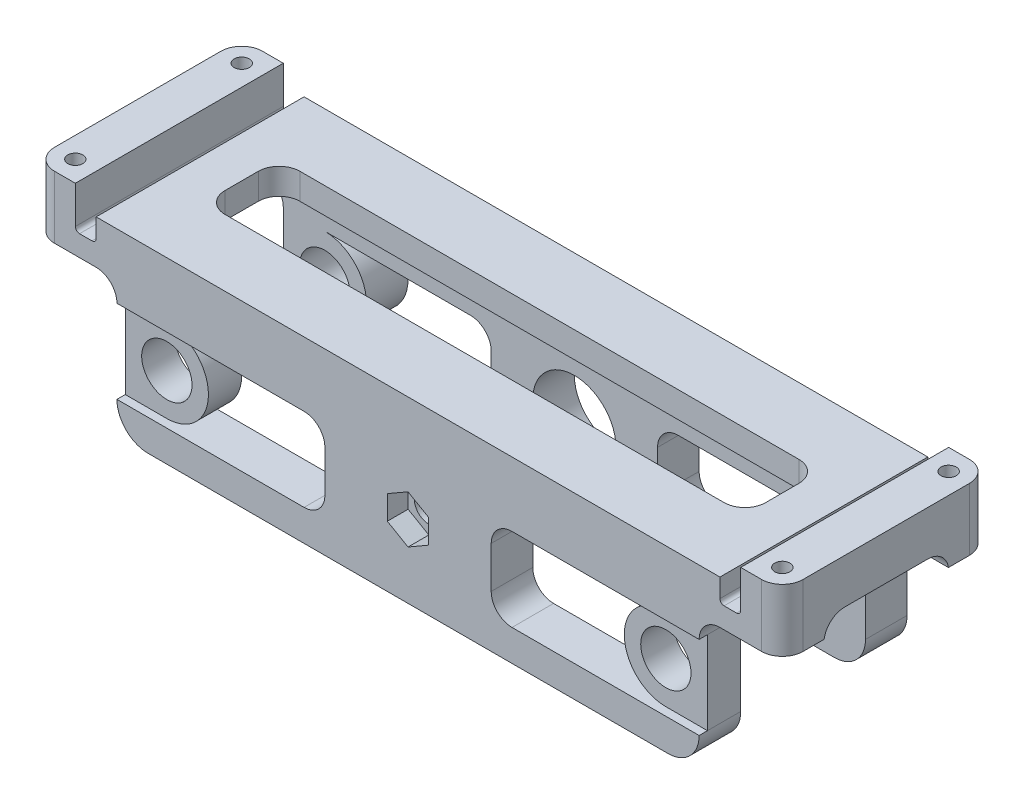
from build123d import *

# Parameters (mm, degrees)
SKETCH_1_W                 = 150
SKETCH_1_H                 = 50
EXTRUDE_1_DEPTH            = 10
CUT_EXTRUDE_5_DEPTH        = 5
SKETCH_6_R                 = 6.05
CUT_EXTRUDE_6_DEPTH        = 80.686887253
CUT_EXTRUDE_7_DEPTH        = 80.686887253
CUT_EXTRUDE_8_DEPTH        = 80.686887253
SKETCH_9_R                 = 3.5
CUT_EXTRUDE_9_DEPTH        = 80.214897721
SKETCH_10_W                = 150
SKETCH_10_H                = 1.5
CUT_EXTRUDE_10_DEPTH       = 80.686887391
SKETCH_11_W                = 150
SKETCH_11_H                = 4.25
EXTRUDE_3_DEPTH            = 15
CUT_EXTRUDE_12_REACH       = 95.152
SKETCH_14_R                = 10
SKETCH_15_W                = 130
SKETCH_15_H                = 18
CUT_EXTRUDE_13_DEPTH       = 93.604333216
FILLET_1_R                 = 5
EXTRUDE_4_DEPTH            = 15
EXTRUDE_5_DEPTH            = 15
FILLET_2_R                 = 5
HOLE_WIZARD_M31_AT_2_COUNT = 2
HOLE_WIZARD_M31_AT_2_PITCH = 40
HOLE_WIZARD_M31_AT_3_COUNT = 2
HOLE_WIZARD_M31_AT_3_PITCH = 170
HOLE_WIZARD_M31_AT_4_COUNT = 2
HOLE_WIZARD_M31_AT_4_PITCH = 174.642491966
CUT_EXTRUDE_20_DEPTH       = 2
SKETCH_22_W                = 5
SKETCH_22_H                = 50
CUT_EXTRUDE_21_DEPTH       = 5
FILLET_3_R                 = 1
FILLET_4_R                 = 5
EXTRUDE_START              = 5
SKETCH_23_R                = 1.825
EXTRUDE_7_DEPTH            = 5
EXTRUDE_START_2            = 2
SKETCH_24_W                = 150
SKETCH_24_H                = 50
EXTRUDE_8_DEPTH            = 2


with BuildPart() as part:
    # Эскиз1 → Бобышка-Вытянуть1 (new body)
    with BuildSketch(Plane.XY):
        Rectangle(SKETCH_1_W, SKETCH_1_H)
    extrude(amount=EXTRUDE_1_DEPTH)

    # Эскиз5 → Вырез-Вытянуть5 (cut)
    with BuildSketch(Plane.XY.offset(10)):
        Polygon((0, 5.75), (-4.979646072, 2.875), (-4.979646072, -2.875), (0, -5.75), (4.979646072, -2.875), (4.979646072, 2.875), align=None)
    extrude(amount=-CUT_EXTRUDE_5_DEPTH, mode=Mode.SUBTRACT)

    # Эскиз6 → Вырез-Вытянуть6 (cut, through all)
    with BuildSketch(Plane.XY.offset(10)):
        with Locations((-60, 0)):
            Circle(SKETCH_6_R)
        with Locations(Location((60, 0, 0), (0, 0, 180))):
            Circle(SKETCH_6_R)
    extrude(amount=-CUT_EXTRUDE_6_DEPTH, mode=Mode.SUBTRACT)

    # Эскиз7 → Вырез-Вытянуть7 (cut, through all)
    with BuildSketch(Plane.XY.offset(10)):
        with BuildLine():
            Line((65, -25), (75, -25))
            Line((75, -25), (75, -15))
            Line((75, -15), (75, 15))
            ThreePointArc((75, 15), (71.464466094, 13.535533906), (70, 10))
            Line((70, 10), (70, -10))
            ThreePointArc((70, -10), (67.803300859, -15.303300859), (62.5, -17.5))
            Line((62.5, -17.5), (27.5, -17.5))
            Line((27.5, -17.5), (-2.5, -17.5))
            Line((-2.5, -17.5), (-32.5, -17.5))
            Line((-32.5, -17.5), (-62.5, -17.5))
            ThreePointArc((-62.5, -17.5), (-67.803300859, -15.303300859), (-70, -10))
            Line((-70, -10), (-70, 10))
            ThreePointArc((-70, 10), (-71.464466094, 13.535533906), (-75, 15))
            Line((-75, 15), (-75, -15))
            Line((-75, -15), (-75, -25))
            Line((-75, -25), (-65, -25))
            Line((-65, -25), (-25, -25))
            Line((-25, -25), (25, -25))
            Line((25, -25), (65, -25))
        make_face()
    extrude(amount=-CUT_EXTRUDE_7_DEPTH, mode=Mode.SUBTRACT)

    # Эскиз8 → Вырез-Вытянуть8 (cut, through all)
    with BuildSketch(Plane(origin=(0, 0, 0), x_dir=(-1, 0, 0), z_dir=(0, 0, -1))):
        with BuildLine():
            Line((20, -5), (20, 5))
            ThreePointArc((20, 5), (21.464466094, 8.535533906), (25, 10))
            Line((25, 10), (45, 10))
            add(Edge.make_bspline(
                [(60, 10), (59.955521003, 10), (54.127943117, 10), (45, 10)],
                knots=[0, 0, 0, 0, 1, 1, 1, 1], degree=3))
            ThreePointArc((60, 10), (50, 0), (60, -10))
            add(Edge.make_bspline(
                [(60, -10), (59.955521003, -10), (54.127943117, -10), (45, -10)],
                knots=[0, 0, 0, 0, 1, 1, 1, 1], degree=3))
            Line((45, -10), (25, -10))
            ThreePointArc((25, -10), (21.464466094, -8.535533906), (20, -5))
        make_face()
        with BuildLine():
            Line((-45, -10), (-25, -10))
            ThreePointArc((-25, -10), (-21.464466094, -8.535533906), (-20, -5))
            Line((-20, -5), (-20, 5))
            ThreePointArc((-20, 5), (-21.464466094, 8.535533906), (-25, 10))
            Line((-25, 10), (-45, 10))
            add(Edge.make_bspline(
                [(-60, 10), (-59.955521003, 10), (-54.127943117, 10), (-45, 10)],
                knots=[0, 0, 0, 0, 1, 1, 1, 1], degree=3))
            ThreePointArc((-60, 10), (-50, 0), (-60, -10))
            add(Edge.make_bspline(
                [(-60, -10), (-59.955521003, -10), (-54.127943117, -10), (-45, -10)],
                knots=[0, 0, 0, 0, 1, 1, 1, 1], degree=3))
        make_face()
    extrude(amount=-CUT_EXTRUDE_8_DEPTH, mode=Mode.SUBTRACT)

    # Эскиз9 → Вырез-Вытянуть9 (cut, through all)
    with BuildSketch(Plane.XY.offset(5)):
        Circle(SKETCH_9_R)
    extrude(amount=-CUT_EXTRUDE_9_DEPTH, mode=Mode.SUBTRACT)

    # Эскиз10 → Вырез-Вытянуть10 (cut, through all)
    with BuildSketch(Plane.XY.offset(10)):
        with Locations((0, 24.25)):
            Rectangle(SKETCH_10_W, SKETCH_10_H)
    extrude(amount=-CUT_EXTRUDE_10_DEPTH, mode=Mode.SUBTRACT)

    # Эскиз11 → Бобышка-Вытянуть3 (add)
    with BuildSketch(Plane(origin=(0, 0, 0), x_dir=(-1, 0, 0), z_dir=(0, 0, -1))):
        with Locations((0, 21.375)):
            Rectangle(SKETCH_11_W, SKETCH_11_H)
    extrude(amount=EXTRUDE_3_DEPTH)

    # Зеркальное отражение9: part across plane


with BuildPart() as part_1:
    add(part.part)
    add(part.part.mirror(Plane(origin=(0, 0, -15), x_dir=(1, 0, 0), z_dir=(0, 0, -1))))

    # Эскиз14 → Вырез-Вытянуть12 (cut, up to next)
    with BuildSketch(Plane(origin=(0, 0, -40), x_dir=(-1, 0, 0), z_dir=(0, 0, -1)), mode=Mode.PRIVATE) as cut_extrude_12_sk1:
        Circle(SKETCH_14_R)
    cut_extrude_12_tool1 = extrude(cut_extrude_12_sk1.sketch, amount=-CUT_EXTRUDE_12_REACH, mode=Mode.PRIVATE) & part_1.part
    add(cut_extrude_12_tool1.solids().sort_by_distance((0, 0, -40))[0], mode=Mode.SUBTRACT)

    # Эскиз15 → Вырез-Вытянуть13 (cut, through all)
    with BuildSketch(Plane.XZ.offset(-19.25)):
        with Locations((0, -15)):
            Rectangle(SKETCH_15_W, SKETCH_15_H)
    extrude(amount=-CUT_EXTRUDE_13_DEPTH, mode=Mode.SUBTRACT)

    # Скругление1
    fillet_1_edges = [part_1.edges().sort_by_distance(p)[0] for p in [
        (65, 21.375, -6),
        (65, 21.375, -24),
        (-65, 21.375, -24),
        (-65, 21.375, -6),
    ]]
    fillet(fillet_1_edges, radius=FILLET_1_R)

    # Эскиз18 → Бобышка-Вытянуть4 (add)
    with BuildSketch(Plane(origin=(75, 0, 0), x_dir=(0, 0, -1), z_dir=(1, 0, 0))):
        Polygon((-10, 23.5), (-10, 15), (0, 15), (0, 19.25), (30, 19.25), (30, 15), (40, 15), (40, 25), (-10, 25), align=None)
    extrude(amount=EXTRUDE_4_DEPTH)

    # Эскиз19 → Бобышка-Вытянуть5 (add)
    with BuildSketch(Plane.ZY.offset(75)):
        Polygon((-40, 15), (-30, 15), (-30, 19.25), (0, 19.25), (0, 15), (10, 15), (10, 25), (-40, 25), align=None)
    extrude(amount=EXTRUDE_5_DEPTH)

    # Скругление2
    fillet_2_edges = [part_1.edges().sort_by_distance(p)[0] for p in [
        (90, 20, 10),
        (90, 20, -40),
        (-90, 20, -40),
        (-90, 20, 10),
    ]]
    fillet(fillet_2_edges, radius=FILLET_2_R)

    # Эскиз20 → Цековка для винта с заклепочной головкой M31 (revolve, cut)
    with BuildSketch(Plane(origin=(-85, 15, -35), x_dir=(0, 0, -1), z_dir=(1, 0, 0))):
        Polygon((0, 0), (0, 10), (1.825, 10), (1.8, 9.975), (1.8, 2.425), (1.825, 2.4), (3.5, 2.4), (3.5, 0.025), (3.525, 0), align=None)
    hole_wizard_m31 = revolve(axis=Axis((-85, 8.65, -35), (0, 1, 0)), mode=Mode.SUBTRACT)

    # Цековка для винта с заклепочной головкой M31 at 2: Цековка для винта с заклепочной головкой M31 ×2
    with Locations(*[(0, 0, i * HOLE_WIZARD_M31_AT_2_PITCH) for i in range(1, HOLE_WIZARD_M31_AT_2_COUNT)]):
        add(hole_wizard_m31, mode=Mode.SUBTRACT)

    # Цековка для винта с заклепочной головкой M31 at 3: Цековка для винта с заклепочной головкой M31 ×2
    with Locations(*[(i * HOLE_WIZARD_M31_AT_3_PITCH, 0, 0) for i in range(1, HOLE_WIZARD_M31_AT_3_COUNT)]):
        add(hole_wizard_m31, mode=Mode.SUBTRACT)

    # Цековка для винта с заклепочной головкой M31 at 4: Цековка для винта с заклепочной головкой M31 ×2
    with Locations(*[Vector(0.9734171683335759, 0, 0.2290393337255473) * (i * HOLE_WIZARD_M31_AT_4_PITCH) for i in range(1, HOLE_WIZARD_M31_AT_4_COUNT)]):
        add(hole_wizard_m31, mode=Mode.SUBTRACT)

    # Эскиз21 → Вырез-Вытянуть20 (cut)
    with BuildSketch(Plane.XY.offset(10)):
        with BuildLine():
            Line((-60, 10), (-70, 10))
            Line((-70, 10), (-70, -10))
            Line((-70, -10), (-60, -10))
            ThreePointArc((-60, -10), (-50, 0), (-60, 10))
        make_face()
        with BuildLine():
            Line((60, 10), (70, 10))
            Line((70, 10), (70, -10))
            Line((70, -10), (60, -10))
            ThreePointArc((60, -10), (50, 0), (60, 10))
        make_face()
    extrude(amount=-CUT_EXTRUDE_20_DEPTH, mode=Mode.SUBTRACT)

    # Эскиз22 → Вырез-Вытянуть21 (cut)
    with BuildSketch(Plane(origin=(0, 25, 0), x_dir=(1, 0, 0), z_dir=(0, 1, 0))):
        with Locations((77.5, 15)):
            Rectangle(SKETCH_22_W, SKETCH_22_H)
        with Locations((-77.5, 15)):
            Rectangle(SKETCH_22_W, SKETCH_22_H)
    extrude(amount=-CUT_EXTRUDE_21_DEPTH, mode=Mode.SUBTRACT)

    # Скругление3
    fillet_3_edges = [part_1.edges().sort_by_distance(p)[0] for p in [
        (75, 20, -15),
        (80, 20, -15),
        (-75, 20, -15),
        (-80, 20, -15),
    ]]
    fillet(fillet_3_edges, radius=FILLET_3_R)

    # Скругление4
    fillet_4_edges = [part_1.edges().sort_by_distance(p)[0] for p in [
        (0, 19.25, 0),
        (0, 19.25, -30),
    ]]
    fillet(fillet_4_edges, radius=FILLET_4_R)

    # Эскиз23 → Бобышка-Вытянуть7 (add)
    # profile 1 of 2: a face of its own
    with BuildSketch(Plane(origin=(0, 25, 0), x_dir=(1, 0, 0), z_dir=(0, 1, 0)).offset(EXTRUDE_START)):
        with BuildLine():
            Line((-80, 40), (-80, -10))
            Line((-80, -10), (-85, -10))
            ThreePointArc((-85, -10), (-88.535533906, -8.535533906), (-90, -5))
            Line((-90, -5), (-90, 35))
            ThreePointArc((-90, 35), (-88.535533906, 38.535533906), (-85, 40))
            Line((-85, 40), (-80, 40))
        make_face()
        with Locations(Location((-85, 35, 0), (0, 0, 90))):
            Circle(SKETCH_23_R, mode=Mode.SUBTRACT)
        with Locations(Location((-85, -5, 0), (0, 0, 90))):
            Circle(SKETCH_23_R, mode=Mode.SUBTRACT)
    # profile 2 of 2: a face of its own
    with BuildSketch(Plane(origin=(0, 25, 0), x_dir=(1, 0, 0), z_dir=(0, 1, 0)).offset(EXTRUDE_START)):
        with BuildLine():
            Line((80, 40), (80, -10))
            Line((80, -10), (85, -10))
            ThreePointArc((85, -10), (88.535533906, -8.535533906), (90, -5))
            Line((90, -5), (90, 35))
            ThreePointArc((90, 35), (88.535533906, 38.535533906), (85, 40))
            Line((85, 40), (80, 40))
        make_face()
        with Locations(Location((85, 35, 0), (0, 0, 90))):
            Circle(SKETCH_23_R, mode=Mode.SUBTRACT)
        with Locations(Location((85, -5, 0), (0, 0, 90))):
            Circle(SKETCH_23_R, mode=Mode.SUBTRACT)
    extrude(amount=-EXTRUDE_7_DEPTH)

    # Эскиз24 → Бобышка-Вытянуть8 (add)
    with BuildSketch(Plane(origin=(0, 23.5, 0), x_dir=(1, 0, 0), z_dir=(0, 1, 0)).offset(EXTRUDE_START_2)):
        with Locations((0, 15)):
            Rectangle(SKETCH_24_W, SKETCH_24_H)
        with BuildLine():
            Line((-60, 24), (60, 24))
            ThreePointArc((60, 24), (63.535533906, 22.535533906), (65, 19))
            Line((65, 19), (65, 11))
            ThreePointArc((65, 11), (63.535533906, 7.464466094), (60, 6))
            Line((60, 6), (-60, 6))
            ThreePointArc((-60, 6), (-63.535533906, 7.464466094), (-65, 11))
            Line((-65, 11), (-65, 19))
            ThreePointArc((-65, 19), (-63.535533906, 22.535533906), (-60, 24))
        make_face(mode=Mode.SUBTRACT)
    extrude(amount=-EXTRUDE_8_DEPTH)


solid = part_1.part
